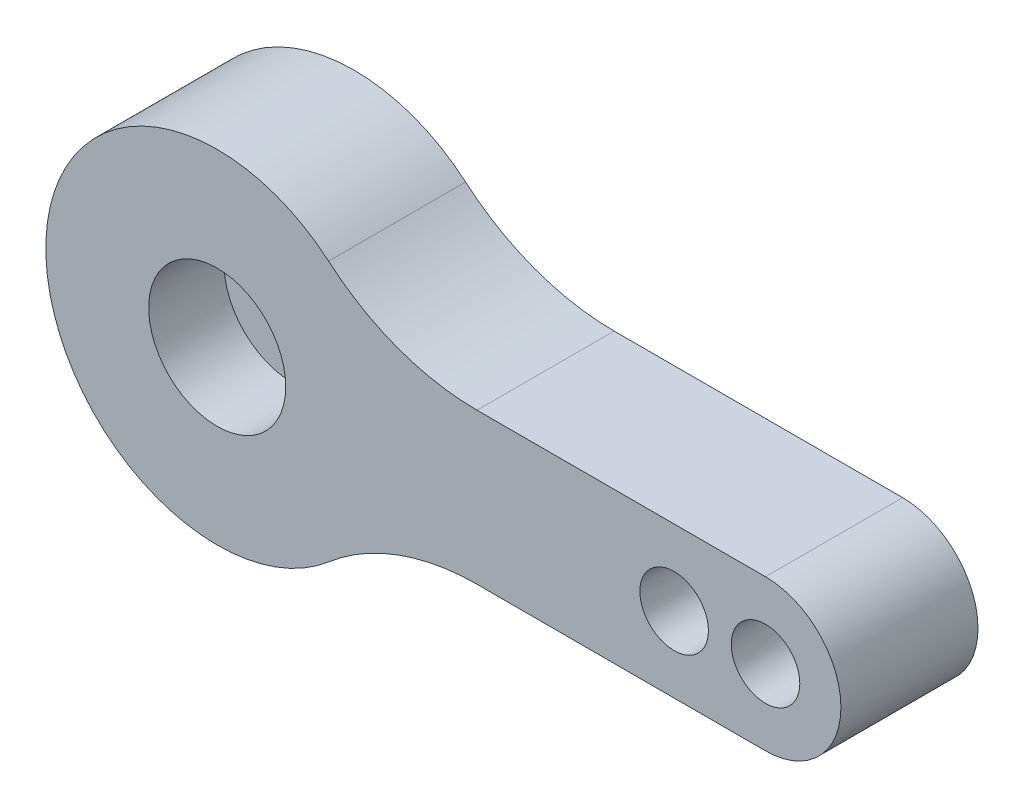
from build123d import *

# Parameters (mm, degrees)
SKETCH_1_R            = 1.5
EXTRUDE_530_DEPTH     = 6
SKETCH_2_R            = 3
CUT_EXTRUDE_709_DEPTH = 3.3


with BuildPart() as part:
    # Эскиз1 → Extrude 530 (new body)
    with BuildSketch(Plane.XY):
        with BuildLine():
            Line((24, 3.3), (11.373653766, 3.3))
            ThreePointArc((11.373653766, 3.3), (7.909552151, 3.91916848), (4.874423043, 5.7))
            ThreePointArc((4.874423043, 5.7), (-7.5, 0), (4.874423043, -5.7))
            ThreePointArc((4.874423043, -5.7), (7.909552151, -3.91916848), (11.373653766, -3.3))
            Line((11.373653766, -3.3), (24, -3.3))
            ThreePointArc((24, -3.3), (27.3, 0), (24, 3.3))
        make_face()
        with Locations((24, 0)):
            Circle(SKETCH_1_R, mode=Mode.SUBTRACT)
        with Locations((20, 0)):
            Circle(SKETCH_1_R, mode=Mode.SUBTRACT)
        Circle(SKETCH_1_R, mode=Mode.SUBTRACT)
    extrude(amount=EXTRUDE_530_DEPTH)

    # Эскиз2 → Cut-Extrude 709 (cut)
    with BuildSketch(Plane.XY.offset(6)):
        Circle(SKETCH_2_R)
    extrude(amount=-CUT_EXTRUDE_709_DEPTH, mode=Mode.SUBTRACT)


solid = part.part
